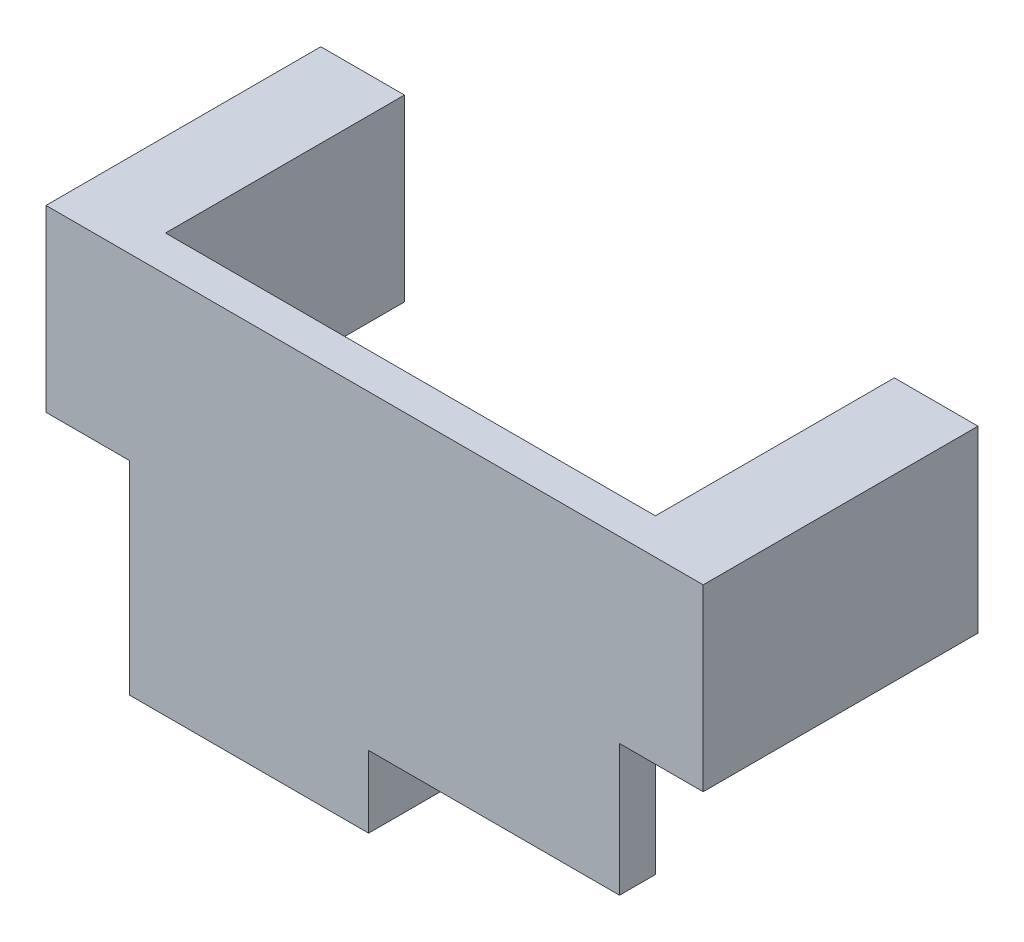
from build123d import *

# Parameters (mm, degrees)
SKETCH1_W           = 41
SKETCH1_H           = 26
BOSS_EXTRUDE1_DEPTH = 3
SKETCH1_3_W         = 20
SKETCH1_3_H         = 6
SKETCH1_3_W_2       = 7
SKETCH1_3_H_2       = 15
BOSS_EXTRUDE2_DEPTH = 23


with BuildPart() as part:
    # Sketch1 → Boss-Extrude1 (new body)
    with BuildSketch(Plane.XY):
        Rectangle(SKETCH1_W, SKETCH1_H)
    extrude(amount=-BOSS_EXTRUDE1_DEPTH)

    # Sketch1<3> → Boss-Extrude2 (add)
    with BuildSketch(Plane.XY):
        with Locations((-10.5, -16)):
            Rectangle(SKETCH1_3_W, SKETCH1_3_H)
        with Locations((-24, 5.5)):
            Rectangle(SKETCH1_3_W_2, SKETCH1_3_H_2)
        with Locations((24, 5.5)):
            Rectangle(SKETCH1_3_W_2, SKETCH1_3_H_2)
    extrude(amount=-BOSS_EXTRUDE2_DEPTH)


solid = part.part
